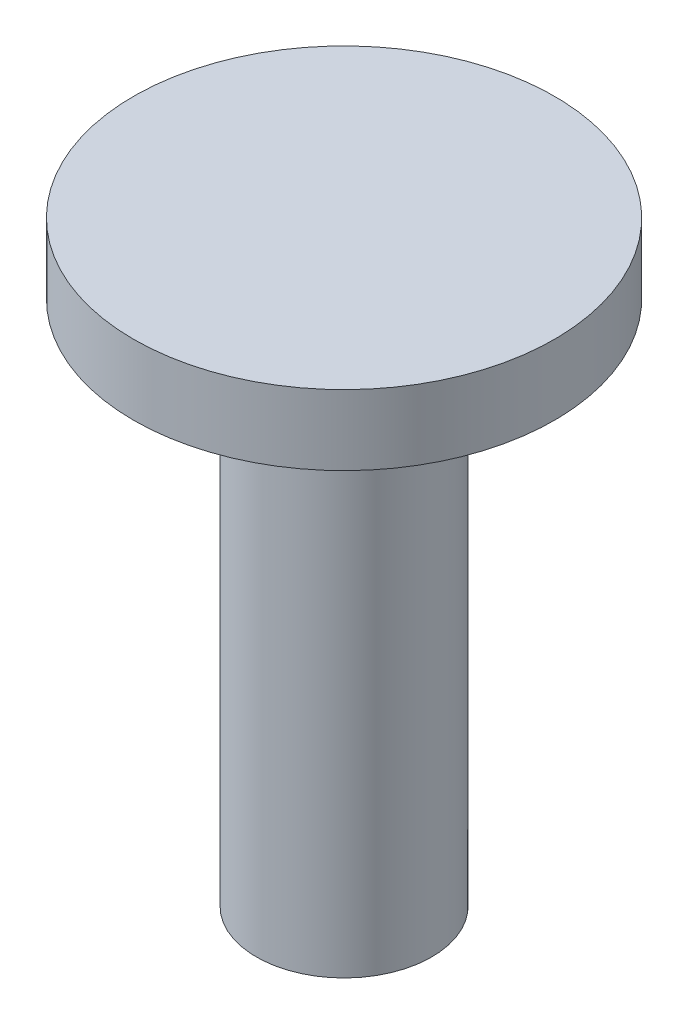
from build123d import *

# Parameters (mm, degrees)
SKETCH_1_R      = 2.4
EXTRUDE_1_DEPTH = 0.8
SKETCH_2_R      = 1
EXTRUDE_2_DEPTH = 6


with BuildPart() as part:
    # 草图1 → 凸台-拉伸1 (new body)
    with BuildSketch(Plane(origin=(0, 0, 0), x_dir=(1, 0, 0), z_dir=(0, 1, 0))):
        with Locations(Location((0, 0, 0), (0, 0, 270))):
            Circle(SKETCH_1_R)
    extrude(amount=EXTRUDE_1_DEPTH)

    # 草图2 → 凸台-拉伸2 (add)
    with BuildSketch(Plane.XZ):
        with Locations(Location((0, 0, 0), (0, 0, 270))):
            Circle(SKETCH_2_R)
    extrude(amount=EXTRUDE_2_DEPTH)


solid = part.part
